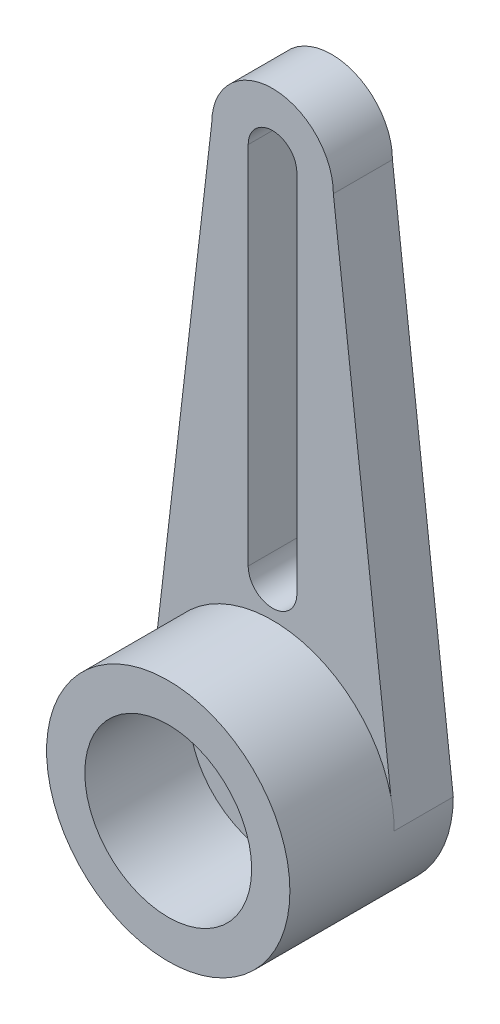
from build123d import *

# Parameters (mm, degrees)
CROQUIS1_R              = 1.1
SALIENTE_EXTRUIR1_DEPTH = 1.7
CROQUIS2_R              = 3.5
CROQUIS2_R_2            = 2.4
SALIENTE_EXTRUIR2_DEPTH = 3
CROQUIS3_R              = 2.25
CORTAR_EXTRUIR1_DEPTH   = 1


with BuildPart() as part:
    # Croquis1 → Saliente-Extruir1 (new body)
    with BuildSketch(Plane.XY):
        with BuildLine():
            ThreePointArc((1.75, 15), (0, 16.75), (-1.75, 15))
            Line((-1.75, 15), (-3.406001644, 0.805700192))
            Line((-3.406001644, 0.805700192), (-3.5, 0))
            ThreePointArc((-3.5, 0), (0, -3.5), (3.5, 0))
            Line((3.5, 0), (3.406001644, 0.805700192))
            Line((3.406001644, 0.805700192), (1.75, 15))
        make_face()
        Circle(CROQUIS1_R, mode=Mode.SUBTRACT)
        with BuildLine():
            ThreePointArc((-0.7, 15), (0, 15.7), (0.7, 15))
            Line((0.7, 15), (0.7, 4.5))
            ThreePointArc((0.7, 4.5), (0, 3.8), (-0.7, 4.5))
            Line((-0.7, 4.5), (-0.7, 15))
        make_face(mode=Mode.SUBTRACT)
    extrude(amount=SALIENTE_EXTRUIR1_DEPTH)

    # Croquis2 → Saliente-Extruir2 (add)
    with BuildSketch(Plane.XY.offset(1.7)):
        Circle(CROQUIS2_R)
        Circle(CROQUIS2_R_2, mode=Mode.SUBTRACT)
    extrude(amount=SALIENTE_EXTRUIR2_DEPTH)

    # Croquis3 → Cortar-Extruir1 (cut)
    with BuildSketch(Plane(origin=(0, 0, 0), x_dir=(-1, 0, 0), z_dir=(0, 0, -1))):
        Circle(CROQUIS3_R)
    extrude(amount=-CORTAR_EXTRUIR1_DEPTH, mode=Mode.SUBTRACT)


solid = part.part
